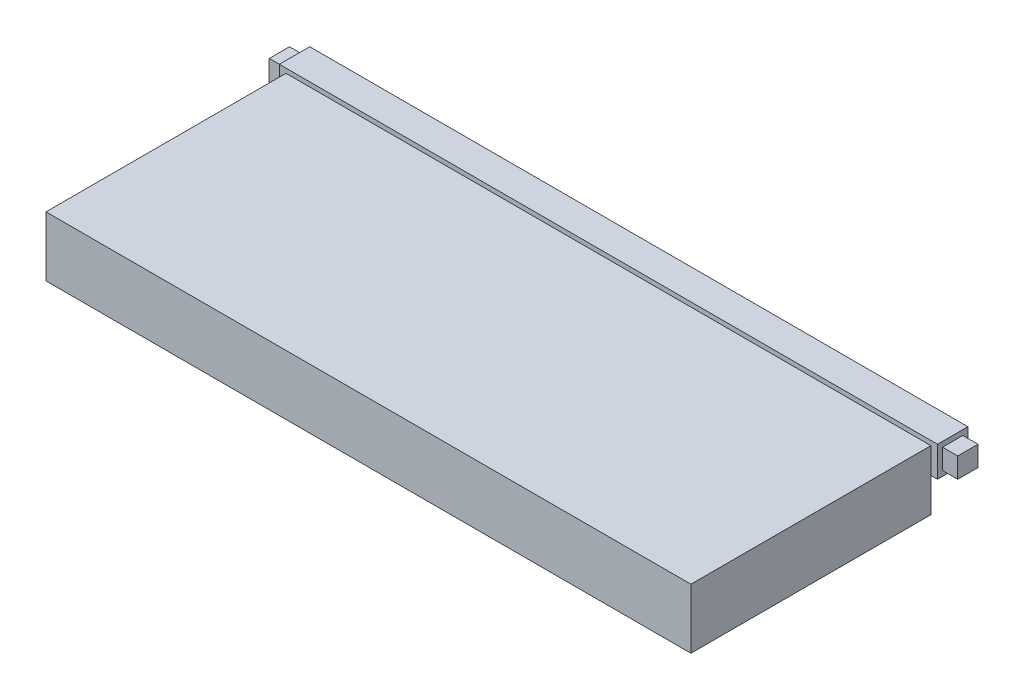
from build123d import *

# Parameters (mm, degrees)
SKETCH1_W           = 650
SKETCH1_H           = 30
BOSS_EXTRUDE1_DEPTH = 30
SKETCH2_W           = 20
SKETCH2_H           = 20
BOSS_EXTRUDE2_DEPTH = 15
SKETCH3_W           = 20
SKETCH3_H           = 20
BOSS_EXTRUDE3_DEPTH = 15
SKETCH4_W           = 636.933542964
SKETCH4_H           = 21.079205472
BOSS_EXTRUDE4_DEPTH = 237
SKETCH6_W           = 636.933542964
SKETCH6_H           = 237
SKETCH6_W_2         = 616.933542964
SKETCH6_H_2         = 217
BOSS_EXTRUDE5_DEPTH = 38


with BuildPart() as part:
    # Sketch1 → Boss-Extrude1 (new body)
    with BuildSketch(Plane(origin=(0, 0, 0), x_dir=(1, 0, 0), z_dir=(0, 1, 0))):
        with Locations((-10.201793722, 9.411434978)):
            Rectangle(SKETCH1_W, SKETCH1_H)
    extrude(amount=BOSS_EXTRUDE1_DEPTH)

    # Sketch2 → Boss-Extrude2 (add)
    with BuildSketch(Plane(origin=(314.798206278, 0, 0), x_dir=(0, 0, -1), z_dir=(1, 0, 0))):
        with Locations((9.411434978, 15)):
            Rectangle(SKETCH2_W, SKETCH2_H)
    extrude(amount=BOSS_EXTRUDE2_DEPTH)

    # Sketch3 → Boss-Extrude3 (add)
    with BuildSketch(Plane.ZY.offset(335.201793722)):
        with Locations((-9.411434978, 15)):
            Rectangle(SKETCH3_W, SKETCH3_H)
    extrude(amount=BOSS_EXTRUDE3_DEPTH)

    # Sketch4 → Boss-Extrude4 (add)
    with BuildSketch(Plane.XY.offset(5.588565022)):
        with Locations((-10.201793722, 15)):
            Rectangle(SKETCH4_W, SKETCH4_H)
    extrude(amount=BOSS_EXTRUDE4_DEPTH)

    # Sketch6 → Boss-Extrude5 (add)
    with BuildSketch(Plane.XZ.offset(-4.460397264)):
        with Locations((-10.201793722, 124.088565022)):
            Rectangle(SKETCH6_W, SKETCH6_H)
        with Locations((-10.201793722, 124.088565022)):
            Rectangle(SKETCH6_W_2, SKETCH6_H_2, mode=Mode.SUBTRACT)
    extrude(amount=BOSS_EXTRUDE5_DEPTH)


solid = part.part
